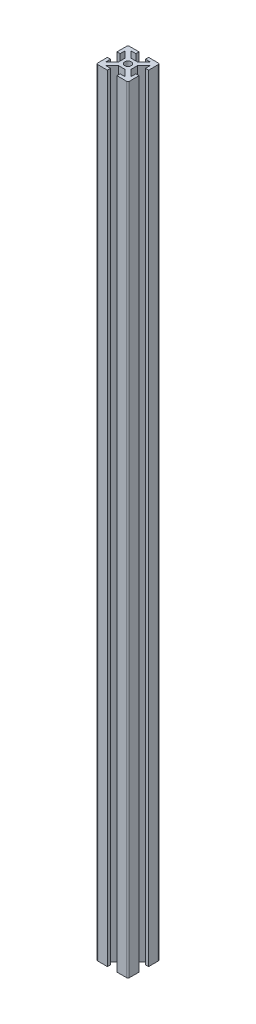
from build123d import *

# Parameters (mm, degrees)
SKETCH_1_R      = 2.1
EXTRUDE_1_DEPTH = 490
FILLET_1_R      = 1


with BuildPart() as part:
    # 草图1 → 凸台-拉伸1 (new body)
    with BuildSketch(Plane(origin=(0, 0, 0), x_dir=(1, 0, 0), z_dir=(0, 1, 0))):
        Polygon((10, 10), (3, 10), (3, 8), (6, 8), (2, 4), (-2, 4), (-6, 8), (-3, 8), (-3, 10), (-10, 10), (-10, 3), (-8, 3), (-8, 6), (-4, 2), (-4, -2), (-8, -6), (-8, -3), (-10, -3), (-10, -10), (-3, -10), (-3, -8), (-6, -8), (-2, -4), (2, -4), (6, -8), (3, -8), (3, -10), (10, -10), (10, -3), (8, -3), (8, -6), (4, -2), (4, 2), (8, 6), (8, 3), (10, 3), align=None)
        with Locations(Location((0, 0, 0), (0, 0, 270))):
            Circle(SKETCH_1_R, mode=Mode.SUBTRACT)
    extrude(amount=EXTRUDE_1_DEPTH)

    # 圆角1
    fillet_1_edges = [part.edges().sort_by_distance(p)[0] for p in [
        (10, 245, 10),
        (-10, 245, 10),
        (-10, 245, -10),
        (10, 245, -10),
    ]]
    fillet(fillet_1_edges, radius=FILLET_1_R)


solid = part.part
